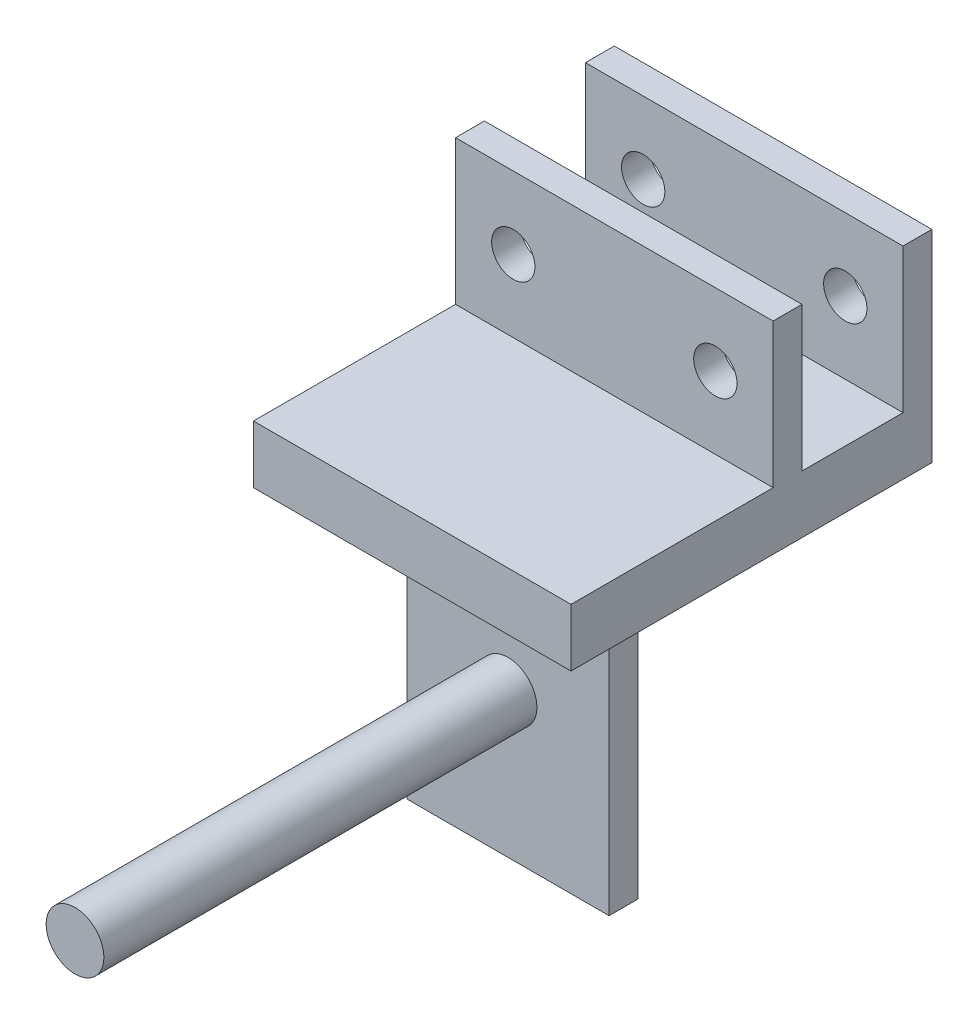
from build123d import *

# Parameters (mm, degrees)
SKETCH_2_W          = 22
SKETCH_2_H          = 25
EXTRUDE_1_DEPTH     = 4
SKETCH_3_W          = 22
SKETCH_3_H          = 2
EXTRUDE_2_DEPTH     = 10
SKETCH_4_R          = 1.5
CUT_EXTRUDE_1_DEPTH = 11
SKETCH_5_W          = 14
SKETCH_5_H          = 2
EXTRUDE_3_DEPTH     = 20
SKETCH_6_R          = 2
EXTRUDE_4_DEPTH     = 30


with BuildPart() as part:
    # Эскиз2 → Бобышка-Вытянуть1 (new body)
    with BuildSketch(Plane(origin=(0, 0, 0), x_dir=(1, 0, 0), z_dir=(0, 1, 0))):
        with Locations((-34.831985697, -17.94161698)):
            Rectangle(SKETCH_2_W, SKETCH_2_H)
    extrude(amount=EXTRUDE_1_DEPTH)

    # Эскиз3 → Бобышка-Вытянуть2 (add)
    with BuildSketch(Plane(origin=(0, 4, 0), x_dir=(1, 0, 0), z_dir=(0, 1, 0))):
        with Locations((-34.831985697, -6.44161698)):
            Rectangle(SKETCH_3_W, SKETCH_3_H)
        with Locations((-34.831985697, -15.44161698)):
            Rectangle(SKETCH_3_W, SKETCH_3_H)
    extrude(amount=EXTRUDE_2_DEPTH)

    # Эскиз4 → Вырез-Вытянуть1 (cut)
    with BuildSketch(Plane.XY.offset(16.44161698)):
        with Locations((-41.831985697, 9)):
            Circle(SKETCH_4_R)
        with Locations((-27.831985697, 9)):
            Circle(SKETCH_4_R)
    extrude(amount=-CUT_EXTRUDE_1_DEPTH, mode=Mode.SUBTRACT)

    # Эскиз5 → Бобышка-Вытянуть3 (add)
    with BuildSketch(Plane.XZ):
        with Locations((-34.831985697, 22.805333719)):
            Rectangle(SKETCH_5_W, SKETCH_5_H)
    extrude(amount=EXTRUDE_3_DEPTH)

    # Эскиз6 → Бобышка-Вытянуть4 (add)
    with BuildSketch(Plane.XY.offset(23.805333719)):
        with Locations(Location((-34.831985697, -10, 0), (0, 0, 180))):
            Circle(SKETCH_6_R)
    extrude(amount=EXTRUDE_4_DEPTH)


solid = part.part
